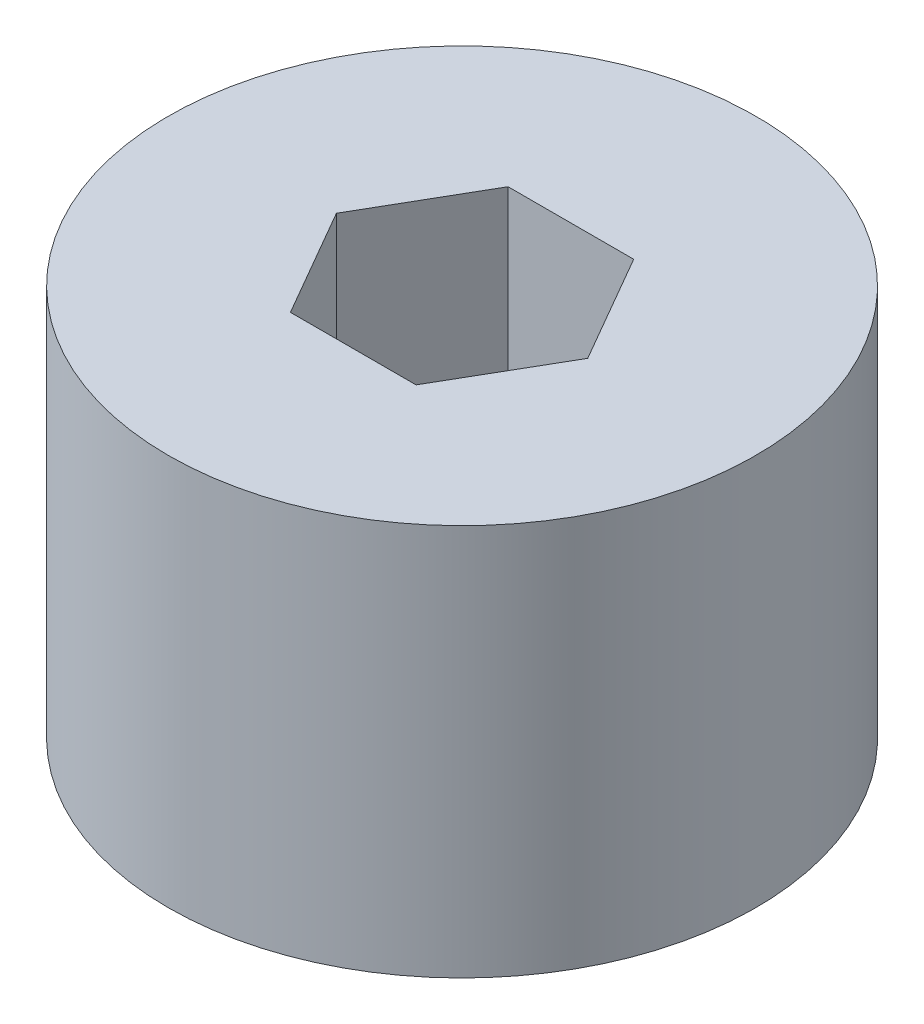
from build123d import *

# Parameters (mm, degrees)
SKETCH1_R           = 17.145
BOSS_EXTRUDE1_DEPTH = 22.86
BOSS_EXTRUDE2_DEPTH = 6.35


with BuildPart() as part:
    # Sketch1 → Boss-Extrude1 (new body)
    with BuildSketch(Plane(origin=(0, 0, 0), x_dir=(1, 0, 0), z_dir=(0, 1, 0))):
        Circle(SKETCH1_R)
        Polygon((7.332348419, 0), (3.666174209, 6.35), (-3.666174209, 6.35), (-7.332348419, 0), (-3.666174209, -6.35), (3.666174209, -6.35), align=None, mode=Mode.SUBTRACT)
    extrude(amount=BOSS_EXTRUDE1_DEPTH)

    # Sketch1<2> → Boss-Extrude2 (add)
    with BuildSketch(Plane(origin=(0, 0, 0), x_dir=(1, 0, 0), z_dir=(0, 1, 0))):
        Polygon((3.666174209, -6.35), (7.332348419, 0), (3.666174209, 6.35), (-3.666174209, 6.35), (-7.332348419, 0), (-3.666174209, -6.35), align=None)
    extrude(amount=BOSS_EXTRUDE2_DEPTH)


solid = part.part
